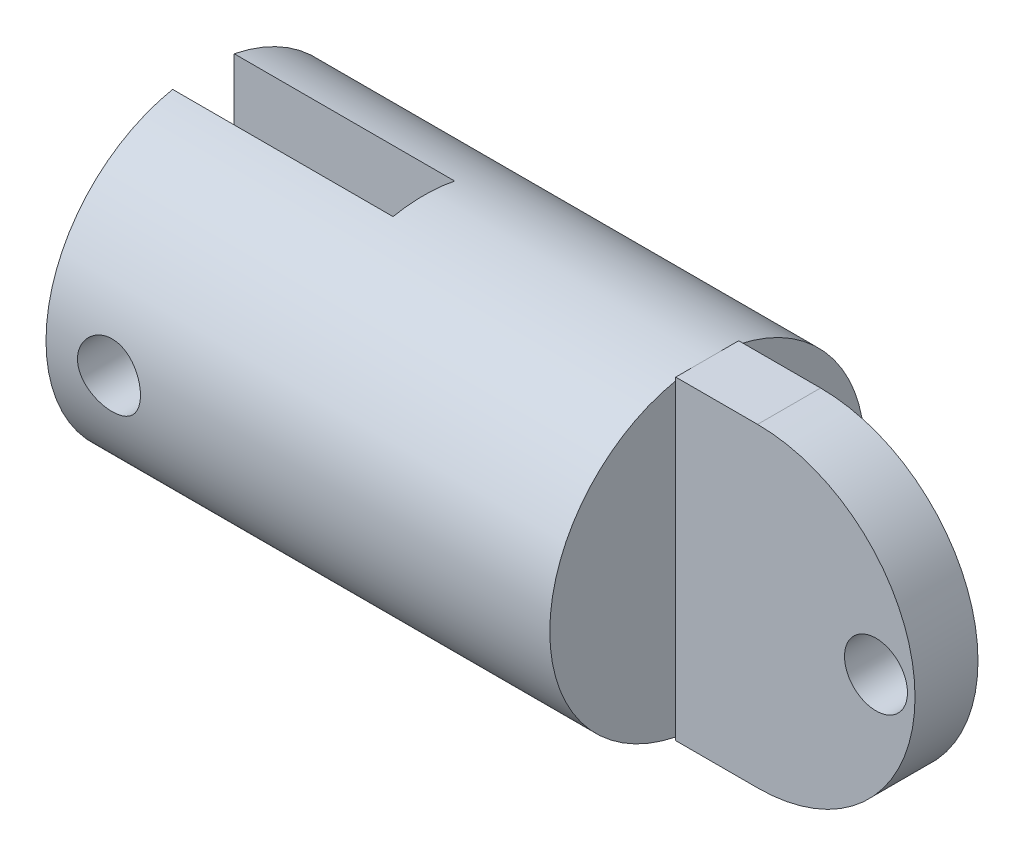
from build123d import *

# Parameters (mm, degrees)
SKETCH1_R               = 12.5
BOSS_EXTRUDE1_DEPTH     = 40
SKETCH6_W               = 5
SKETCH6_H               = 25
BOSS_EXTRUDE3_DEPTH     = 6.5
BOSS_EXTRUDE4_DEPTH     = 5
CUT_EXTRUDE1_DEPTH      = 45.511234537
CUT_EXTRUDE1_DEPTH_BACK = 45.511234537
SKETCH10_R              = 2.5
SKETCH12_W              = 4.8936145
SKETCH12_H              = 25
CUT_EXTRUDE2_DEPTH      = 17.5
CUT_EXTRUDE3_DEPTH      = 44.732139211
CUT_EXTRUDE3_DEPTH_BACK = 44.732139211
SKETCH13_R              = 2.5


with BuildPart() as part:
    # Sketch1 → Boss-Extrude1 (new body)
    with BuildSketch(Plane(origin=(0, 0, 0), x_dir=(0, 0, -1), z_dir=(1, 0, 0))):
        Circle(SKETCH1_R)
    extrude(amount=-BOSS_EXTRUDE1_DEPTH)

    # Sketch6 → Boss-Extrude3 (add)
    with BuildSketch(Plane(origin=(0, 0, 0), x_dir=(0, 0, -1), z_dir=(1, 0, 0))):
        Rectangle(SKETCH6_W, SKETCH6_H)
    extrude(amount=BOSS_EXTRUDE3_DEPTH)

    # Sketch8 → Boss-Extrude4 (add)
    with BuildSketch(Plane.XY.offset(2.5)):
        with BuildLine():
            Line((6.5, 12.5), (6.5, -12.5))
            ThreePointArc((6.5, -12.5), (19, 0), (6.5, 12.5))
        make_face()
    extrude(amount=-BOSS_EXTRUDE4_DEPTH)

    # Sketch10 → Cut-Extrude1 (cut, two sides: drawn at the far end of the back side and taken through both)
    with BuildSketch(Plane.XY.offset(2.5).offset(-CUT_EXTRUDE1_DEPTH_BACK)):
        with Locations((15.9, 0)):
            Circle(SKETCH10_R)
    extrude(amount=CUT_EXTRUDE1_DEPTH + CUT_EXTRUDE1_DEPTH_BACK, mode=Mode.SUBTRACT)

    # Sketch12 → Cut-Extrude2 (cut)
    with BuildSketch(Plane.ZY.offset(40)):
        Rectangle(SKETCH12_W, SKETCH12_H)
    extrude(amount=-CUT_EXTRUDE2_DEPTH, mode=Mode.SUBTRACT)

    # Sketch13 → Cut-Extrude3 (cut, two sides: drawn at the far end of the back side and taken through both)
    with BuildSketch(Plane.XY.offset(-CUT_EXTRUDE3_DEPTH_BACK)):
        with Locations((-35, 0)):
            Circle(SKETCH13_R)
    extrude(amount=CUT_EXTRUDE3_DEPTH + CUT_EXTRUDE3_DEPTH_BACK, mode=Mode.SUBTRACT)


solid = part.part
